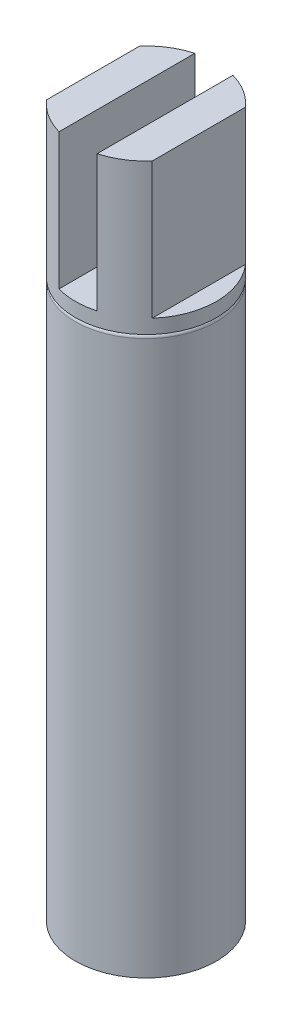
from build123d import *

# Parameters (mm, degrees)
SKETCH1_R           = 10
BOSS_EXTRUDE1_DEPTH = 79
FILLET1_R           = 0.5
SKETCH2_R           = 10
BOSS_EXTRUDE2_DEPTH = 2
BOSS_EXTRUDE3_DEPTH = 19.3


with BuildPart() as part:
    # Sketch1 → Boss-Extrude1 (new body)
    with BuildSketch(Plane(origin=(0, 0, 0), x_dir=(1, 0, 0), z_dir=(0, 1, 0))):
        with Locations(Location((0, 0, 0), (0, 0, 270))):
            Circle(SKETCH1_R)
    extrude(amount=BOSS_EXTRUDE1_DEPTH)

    # Fillet1
    fillet1_edges = [part.edges().sort_by_distance(p)[0] for p in [
        (0, 79, -10),
    ]]
    fillet(fillet1_edges, radius=FILLET1_R)

    # Sketch2 → Boss-Extrude2 (add)
    with BuildSketch(Plane(origin=(0, 79, 0), x_dir=(1, 0, 0), z_dir=(0, 1, 0))):
        with Locations(Location((0, 0, 0), (0, 0, 270))):
            Circle(SKETCH2_R)
    extrude(amount=BOSS_EXTRUDE2_DEPTH)

    # Sketch3 → Boss-Extrude3 (add)
    with BuildSketch(Plane(origin=(0, 81, 0), x_dir=(1, 0, 0), z_dir=(0, 1, 0))):
        with BuildLine():
            ThreePointArc((-2.7, 9.628603222), (-5.318024822, 8.468684195), (-7.5, 6.614378278))
            Line((-7.5, 6.614378278), (-7.5, -6.614378278))
            ThreePointArc((-7.5, -6.614378278), (-5.318024822, -8.468684195), (-2.7, -9.628603222))
            Line((-2.7, -9.628603222), (-2.7, 9.628603222))
        make_face()
        with BuildLine():
            ThreePointArc((7.5, 6.614378278), (5.318024822, 8.468684195), (2.7, 9.628603222))
            Line((2.7, 9.628603222), (2.7, -9.628603222))
            ThreePointArc((2.7, -9.628603222), (5.318024822, -8.468684195), (7.5, -6.614378278))
            Line((7.5, -6.614378278), (7.5, 6.614378278))
        make_face()
    extrude(amount=BOSS_EXTRUDE3_DEPTH)


solid = part.part
